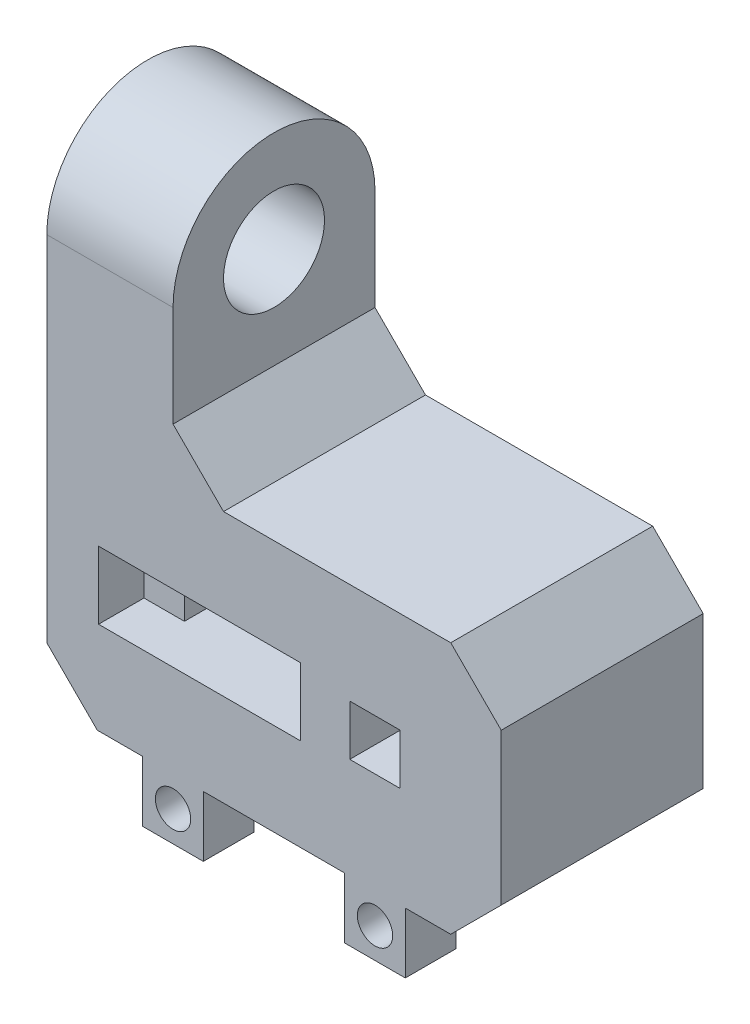
from build123d import *

# Parameters (mm, degrees)
SKETCH1_W           = 90
SKETCH1_H           = 50
BOSS_EXTRUDE1_DEPTH = 40
SKETCH21_R          = 5
CUT_EXTRUDE10_DEPTH = 40
SKETCH22_W          = 40
SKETCH22_H          = 13.4
CUT_EXTRUDE11_DEPTH = 9
SKETCH24_W          = 24
SKETCH24_H          = 13.4
CUT_EXTRUDE12_DEPTH = 31
SKETCH25_R          = 1.1
CUT_EXTRUDE13_DEPTH = 31
SKETCH31_W          = 25
SKETCH31_H          = 40
BOSS_EXTRUDE2_DEPTH = 50
SKETCH32_R          = 10
CUT_EXTRUDE15_DEPTH = 25
CHAMFER1_SIZE       = 10
CUT_EXTRUDE16_REACH = 142.357
SKETCH35_W          = 15
SKETCH35_H          = 20
SKETCH36_W          = 12
SKETCH36_H          = 12
SKETCH36_R          = 3.5
BOSS_EXTRUDE3_DEPTH = 10


with BuildPart() as part:
    # Sketch1 → Boss-Extrude1 (new body)
    with BuildSketch(Plane.XY):
        with Locations((-45, 25)):
            Rectangle(SKETCH1_W, SKETCH1_H)
    extrude(amount=BOSS_EXTRUDE1_DEPTH)

    # Sketch21 → Cut-Extrude10 (cut)
    with BuildSketch(Plane.XY.offset(40)):
        with Locations((-25, 25)):
            Circle(SKETCH21_R)
        with BuildLine():
            Line((-25, 30), (-30, 30))
            Line((-30, 30), (-30, 25))
            ThreePointArc((-30, 25), (-28.535533906, 28.535533906), (-25, 30))
        make_face()
        with BuildLine():
            ThreePointArc((-25, 20), (-28.535533906, 21.464466094), (-30, 25))
            Line((-30, 25), (-30, 20))
            Line((-30, 20), (-25, 20))
        make_face()
        with BuildLine():
            Line((-20, 20), (-20, 25))
            ThreePointArc((-20, 25), (-21.464466094, 21.464466094), (-25, 20))
            Line((-25, 20), (-20, 20))
        make_face()
        with BuildLine():
            Line((-20, 30), (-25, 30))
            ThreePointArc((-25, 30), (-21.464466094, 28.535533906), (-20, 25))
            Line((-20, 25), (-20, 30))
        make_face()
    extrude(amount=-CUT_EXTRUDE10_DEPTH, mode=Mode.SUBTRACT)

    # Sketch22 → Cut-Extrude11 (cut)
    with BuildSketch(Plane.XY.offset(40)):
        with Locations((-59.75, 25)):
            Rectangle(SKETCH22_W, SKETCH22_H)
    extrude(amount=-CUT_EXTRUDE11_DEPTH, mode=Mode.SUBTRACT)

    # Sketch24 → Cut-Extrude12 (cut)
    with BuildSketch(Plane.XY.offset(31)):
        with Locations((-59.75, 25)):
            Rectangle(SKETCH24_W, SKETCH24_H)
    extrude(amount=-CUT_EXTRUDE12_DEPTH, mode=Mode.SUBTRACT)

    # Sketch25 → Cut-Extrude13 (cut)
    with BuildSketch(Plane.XY.offset(31)):
        with Locations((-73.25, 25)):
            Circle(SKETCH25_R)
        with Locations((-46.25, 25)):
            Circle(SKETCH25_R)
    extrude(amount=-CUT_EXTRUDE13_DEPTH, mode=Mode.SUBTRACT)

    # Sketch31 → Boss-Extrude2 (add)
    with BuildSketch(Plane(origin=(0, 50, 0), x_dir=(1, 0, 0), z_dir=(0, 1, 0))):
        with Locations((-77.5, -20)):
            Rectangle(SKETCH31_W, SKETCH31_H)
    extrude(amount=BOSS_EXTRUDE2_DEPTH)

    # Sketch32 → Cut-Extrude15 (cut)
    with BuildSketch(Plane(origin=(-65, 0, 0), x_dir=(0, 0, -1), z_dir=(1, 0, 0))):
        with BuildLine():
            ThreePointArc((-40, 80), (-34.142135624, 94.142135624), (-20, 100))
            Line((-20, 100), (-40, 100))
            Line((-40, 100), (-40, 80))
        make_face()
        with BuildLine():
            ThreePointArc((-20, 100), (-5.857864376, 94.142135624), (0, 80))
            Line((0, 80), (0, 100))
            Line((0, 100), (-20, 100))
        make_face()
        with Locations((-20, 80)):
            Circle(SKETCH32_R)
    extrude(amount=-CUT_EXTRUDE15_DEPTH, mode=Mode.SUBTRACT)

    # Chamfer1
    chamfer1_edges = [part.edges().sort_by_distance(p)[0] for p in [
        (-65, 50, 20),
        (0, 50, 20),
        (0, 0, 20),
        (-90, 0, 20),
    ]]
    chamfer(chamfer1_edges, length=CHAMFER1_SIZE)

    # Cut-Extrude16: up to this face of the body (flat: up to its plane)
    cut_extrude16_end = Plane(part.part.faces().sort_by_distance((-47.75, 25, 15.5))[0])
    # Sketch35 → Cut-Extrude16 (cut, up to the picked face)
    with BuildSketch(Plane.ZY.offset(90), mode=Mode.PRIVATE) as cut_extrude16_sk1:
        with Locations((14.686432503, 25)):
            Rectangle(SKETCH35_W, SKETCH35_H)
    cut_extrude16_tool1 = split(extrude(cut_extrude16_sk1.sketch, amount=-CUT_EXTRUDE16_REACH, mode=Mode.PRIVATE), bisect_by=cut_extrude16_end, keep=Keep.BOTH, mode=Mode.PRIVATE)
    add(cut_extrude16_tool1.solids().sort_by(Axis((-90, 25, 14.686433), (1, 0, 0)))[0], mode=Mode.SUBTRACT)

    # Sketch36 → Boss-Extrude3 (add)
    # profile 1 of 2: a face of its own
    with BuildSketch(Plane.XY.offset(40)):
        with Locations((-65, -6)):
            Rectangle(SKETCH36_W, SKETCH36_H)
        with Locations((-65, -6)):
            Circle(SKETCH36_R, mode=Mode.SUBTRACT)
    # profile 2 of 2: a face of its own
    with BuildSketch(Plane.XY.offset(40)):
        with Locations((-25, -6)):
            Rectangle(SKETCH36_W, SKETCH36_H)
        with Locations((-25, -6)):
            Circle(SKETCH36_R, mode=Mode.SUBTRACT)
    extrude(amount=-BOSS_EXTRUDE3_DEPTH)


solid = part.part
